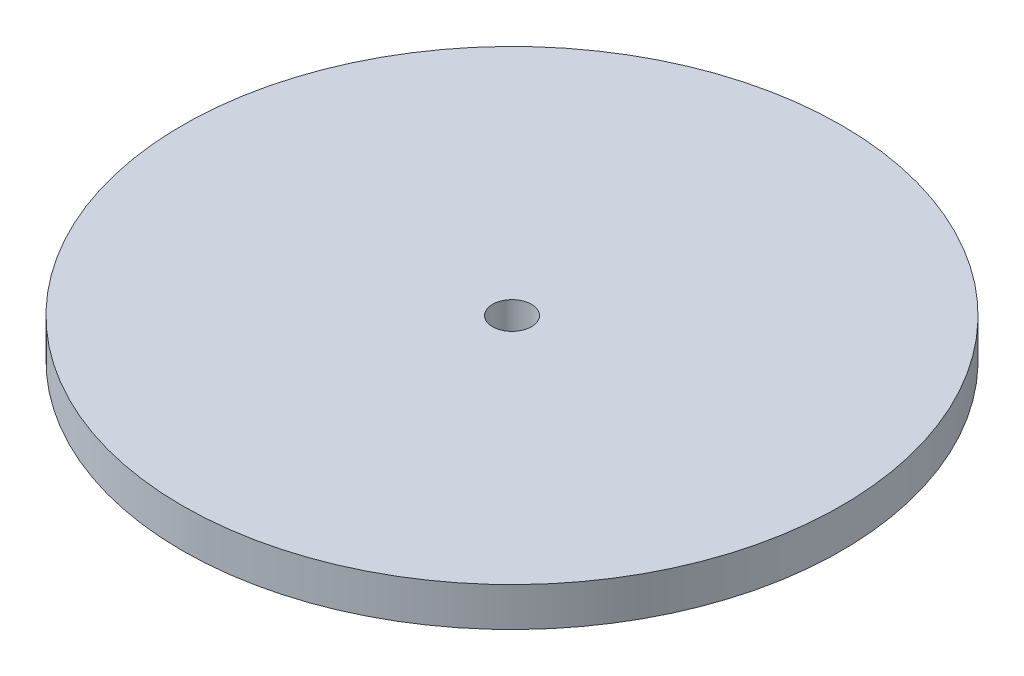
from build123d import *

# Parameters (mm, degrees)
SKETCH1_R           = 107.5
SKETCH1_R_2         = 6.35
BOSS_EXTRUDE1_DEPTH = 12.7


with BuildPart() as part:
    # Sketch1 → Boss-Extrude1 (new body)
    with BuildSketch(Plane(origin=(0, 0, 0), x_dir=(1, 0, 0), z_dir=(0, 1, 0))):
        with Locations(Location((0, 0, 0), (0, 0, 270))):
            Circle(SKETCH1_R)
        with Locations(Location((0, 0, 0), (0, 0, 270))):
            Circle(SKETCH1_R_2, mode=Mode.SUBTRACT)
    extrude(amount=BOSS_EXTRUDE1_DEPTH)


solid = part.part
